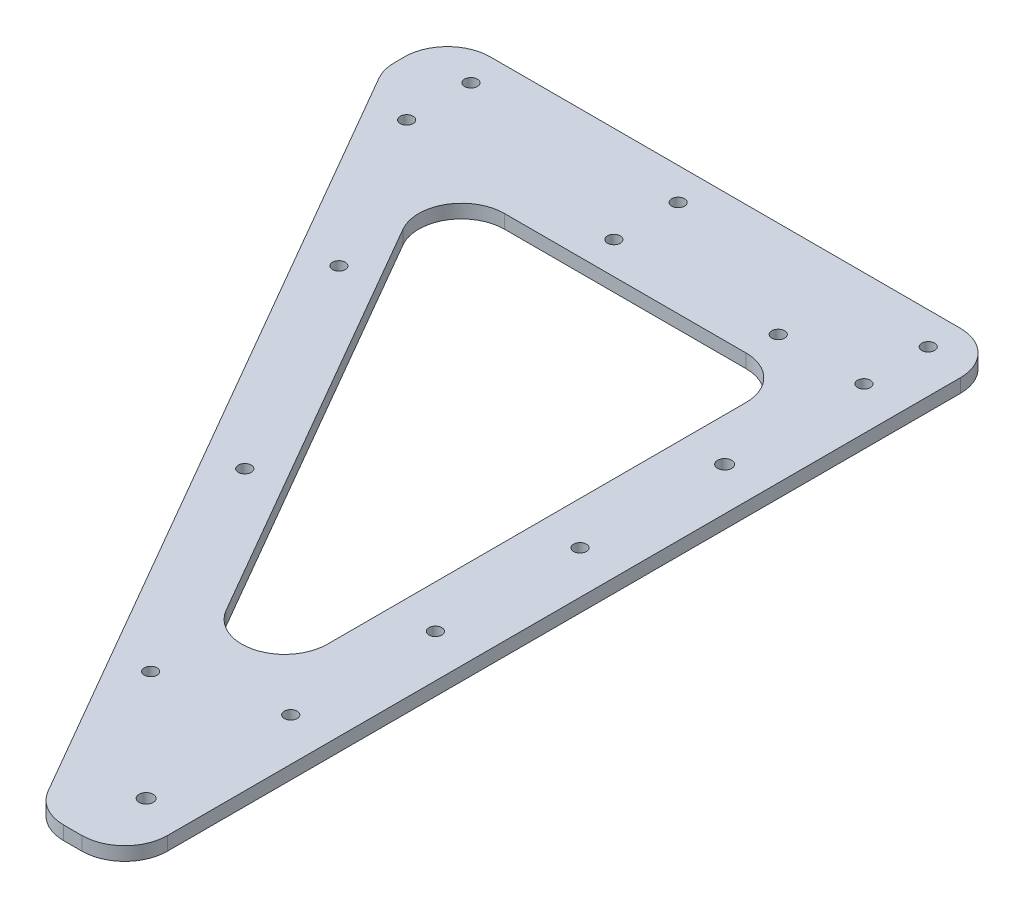
from build123d import *

# Parameters (mm, degrees)
SKETCH1_R           = 1.5
SKETCH1_R_2         = 1.65
BOSS_EXTRUDE1_DEPTH = 3.175
SKETCH2_W           = 129.696551146
SKETCH2_H           = 15
SKETCH2_R           = 1.5
BOSS_EXTRUDE2_DEPTH = 3.175
FILLET1_R           = 10


with BuildPart() as part:
    # Sketch1 → Boss-Extrude1 (new body)
    with BuildSketch(Plane(origin=(0, 0, 0), x_dir=(1, 0, 0), z_dir=(0, 1, 0))):
        Polygon((-20, -190), (0, -190), (0, 0), (-129.696551146, 0), align=None)
        with Locations(Location((-65.10548978, -96.875, 0), (0, 0, 270))):
            Circle(SKETCH1_R, mode=Mode.SUBTRACT)
        with Locations(Location((-10, -175, 0), (0, 0, 270))):
            Circle(SKETCH1_R_2, mode=Mode.SUBTRACT)
        with Locations(Location((-35.10548978, -148.836524227, 0), (0, 0, 270))):
            Circle(SKETCH1_R, mode=Mode.SUBTRACT)
        with BuildLine():
            ThreePointArc((-10, -139.75), (-8.5, -141.25), (-10, -142.75))
            ThreePointArc((-10, -142.75), (-11.5, -141.25), (-10, -139.75))
        make_face(mode=Mode.SUBTRACT)
        with BuildLine():
            ThreePointArc((-10, -106), (-8.5, -107.5), (-10, -109))
            ThreePointArc((-10, -109), (-11.5, -107.5), (-10, -106))
        make_face(mode=Mode.SUBTRACT)
        with Locations(Location((-95.10548978, -44.913475773, 0), (0, 0, 270))):
            Circle(SKETCH1_R, mode=Mode.SUBTRACT)
        with Locations(Location((-116.706170089, -7.5, 0), (0, 0, 270))):
            Circle(SKETCH1_R, mode=Mode.SUBTRACT)
        with Locations(Location((-68.353085045, -7.5, 0), (0, 0, 270))):
            Circle(SKETCH1_R, mode=Mode.SUBTRACT)
        Polygon((-20, -15), (-20, -160), (-103.715789032, -15), align=None, mode=Mode.SUBTRACT)
        with BuildLine():
            ThreePointArc((-10, -72.25), (-8.5, -73.75), (-10, -75.25))
            ThreePointArc((-10, -75.25), (-11.5, -73.75), (-10, -72.25))
        make_face(mode=Mode.SUBTRACT)
        with Locations(Location((-10, -40, 0), (0, 0, 270))):
            Circle(SKETCH1_R_2, mode=Mode.SUBTRACT)
        with Locations(Location((-30, -7.5, 0), (0, 0, 270))):
            Circle(SKETCH1_R, mode=Mode.SUBTRACT)
        with Locations(Location((-10, -7.5, 0), (0, 0, 270))):
            Circle(SKETCH1_R, mode=Mode.SUBTRACT)
    extrude(amount=BOSS_EXTRUDE1_DEPTH)

    # Sketch2 → Boss-Extrude2 (add)
    with BuildSketch(Plane.XZ):
        with Locations((-64.848275573, -7.5)):
            Rectangle(SKETCH2_W, SKETCH2_H)
        with Locations(Location((-116.706170089, -7.5, 0), (0, 0, 270))):
            Circle(SKETCH2_R, mode=Mode.SUBTRACT)
        with Locations(Location((-68.353085045, -7.5, 0), (0, 0, 270))):
            Circle(SKETCH2_R, mode=Mode.SUBTRACT)
        with Locations(Location((-10, -7.5, 0), (0, 0, 270))):
            Circle(SKETCH2_R, mode=Mode.SUBTRACT)
    extrude(amount=-BOSS_EXTRUDE2_DEPTH)

    # Fillet1
    fillet1_edges = [part.edges().sort_by_distance(p)[0] for p in [
        (0, 1.5875, 190),
        (-20, 1.5875, 190),
        (-129.696551146, 1.5875, 0),
        (-103.715789032, 1.5875, 15),
        (-20, 1.5875, 160),
        (-20, 1.5875, 15),
        (0, 1.5875, -15),
        (-129.696551146, 1.5875, -15),
    ]]
    fillet(fillet1_edges, radius=FILLET1_R)


solid = part.part
